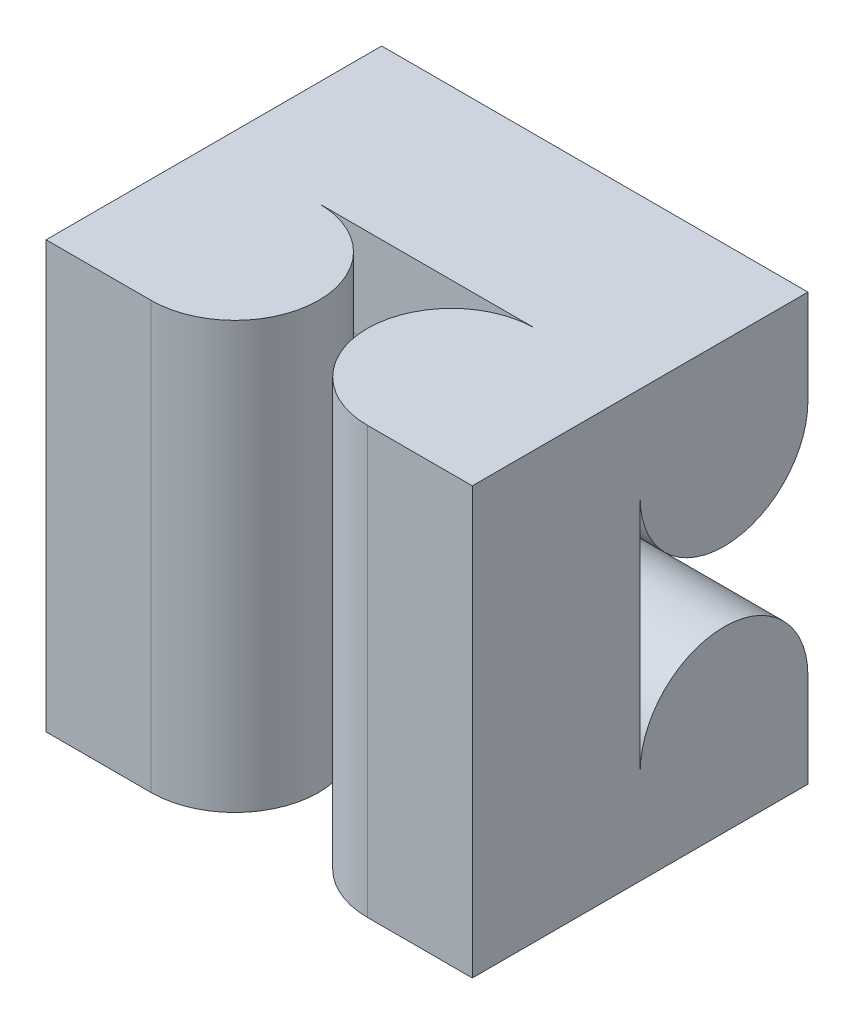
from build123d import *

# Parameters (mm, degrees)
DODANIE_WYCI_GNI_CIE1_DEPTH   = 0.508
DODANIE_WYCI_GNI_CIE1_2_DEPTH = 0.508
DODANIE_WYCI_GNI_CIE2_DEPTH   = 0.254


with BuildPart() as part:
    # Szkic1 → Dodanie-wyciągnięcie1 (new body)
    with BuildSketch(Plane(origin=(0, 0, 0), x_dir=(1, 0, 0), z_dir=(0, 1, 0))):
        with BuildLine():
            Line((-0.254, 0), (-0.129, 0))
            ThreePointArc((-0.129, 0), (-0.029, 0.1), (-0.129, 0.2))
            Line((-0.129, 0.2), (-0.254, 0.2))
            Line((-0.254, 0.2), (-0.254, 0))
        make_face()
    extrude(amount=DODANIE_WYCI_GNI_CIE1_DEPTH)



with BuildPart() as body_2:
    # Szkic1 → Dodanie-wyci_gni_cie1 2 (new body)
    with BuildSketch(Plane(origin=(0, 0, 0), x_dir=(1, 0, 0), z_dir=(0, 1, 0))):
        with BuildLine():
            Line((0.129, 0.2), (0.254, 0.2))
            Line((0.254, 0.2), (0.254, 0))
            Line((0.254, 0), (0.129, 0))
            ThreePointArc((0.129, 0), (0.029, 0.1), (0.129, 0.2))
        make_face()
    extrude(amount=DODANIE_WYCI_GNI_CIE1_2_DEPTH)


with BuildPart() as part_1:
    add(part.part)

    add(body_2.part)  # Dodanie-wyciągnięcie2 merges body 2
    # Szkic4 → Dodanie-wyciągnięcie2 (add, symmetric)
    with BuildSketch(Plane(origin=(0, 0, 0), x_dir=(0, 0, -1), z_dir=(1, 0, 0))):
        with BuildLine():
            Line((0.2, 0.508), (0.4, 0.508))
            Line((0.4, 0.508), (0.4, 0.3955))
            ThreePointArc((0.4, 0.3955), (0.3, 0.2955), (0.2, 0.3955))
            Line((0.2, 0.3955), (0.2, 0.508))
        make_face()
        with BuildLine():
            Line((0.2, 0), (0.4, 0))
            Line((0.4, 0), (0.4, 0.1125))
            ThreePointArc((0.4, 0.1125), (0.3, 0.2125), (0.2, 0.1125))
            Line((0.2, 0.1125), (0.2, 0))
        make_face()
    extrude(amount=DODANIE_WYCI_GNI_CIE2_DEPTH, both=True)


solid = part_1.part
